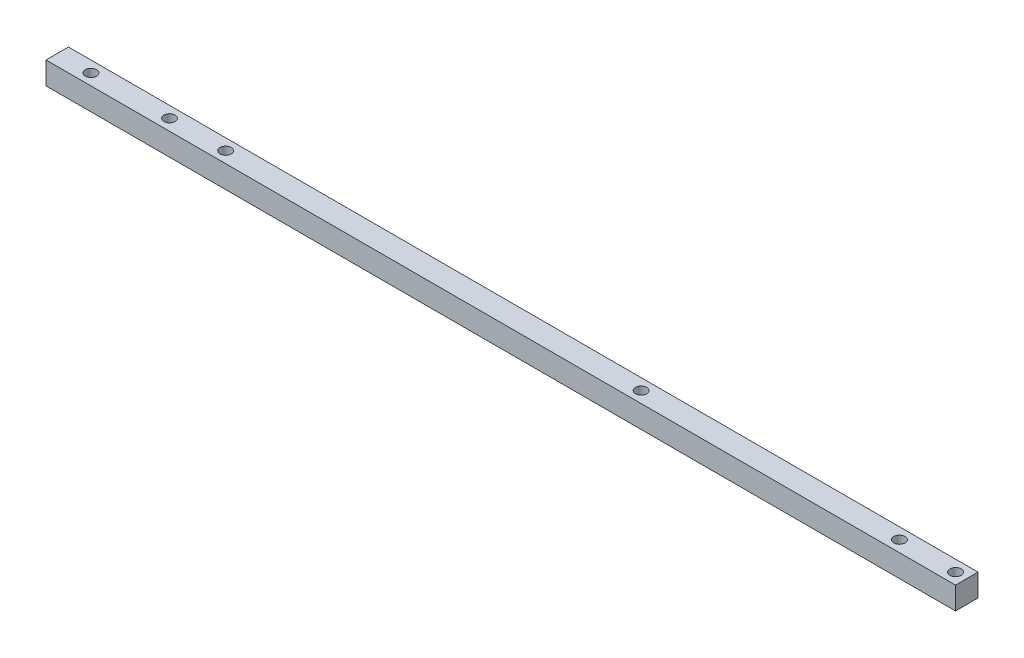
from build123d import *

# Parameters (mm, degrees)
SKETCH1_W           = 257.175
SKETCH1_H           = 6.35
SKETCH1_R           = 1.5875
BOSS_EXTRUDE1_DEPTH = 6.35


with BuildPart() as part:
    # Sketch1 → Boss-Extrude1 (new body)
    with BuildSketch(Plane(origin=(0, 0, 0), x_dir=(1, 0, 0), z_dir=(0, 1, 0))):
        with Locations((128.5875, 3.175)):
            Rectangle(SKETCH1_W, SKETCH1_H)
        with Locations(Location((31.75, 3.175, 0), (0, 0, 270))):
            Circle(SKETCH1_R, mode=Mode.SUBTRACT)
        with Locations(Location((165.1, 3.175, 0), (0, 0, 270))):
            Circle(SKETCH1_R, mode=Mode.SUBTRACT)
        with Locations(Location((238.125, 3.175, 0), (0, 0, 270))):
            Circle(SKETCH1_R, mode=Mode.SUBTRACT)
        with Locations(Location((9.525, 3.175, 0), (0, 0, 270))):
            Circle(SKETCH1_R, mode=Mode.SUBTRACT)
        with Locations(Location((47.625, 3.175, 0), (0, 0, 270))):
            Circle(SKETCH1_R, mode=Mode.SUBTRACT)
        with Locations(Location((254, 3.175, 0), (0, 0, 270))):
            Circle(SKETCH1_R, mode=Mode.SUBTRACT)
    extrude(amount=BOSS_EXTRUDE1_DEPTH)


solid = part.part
